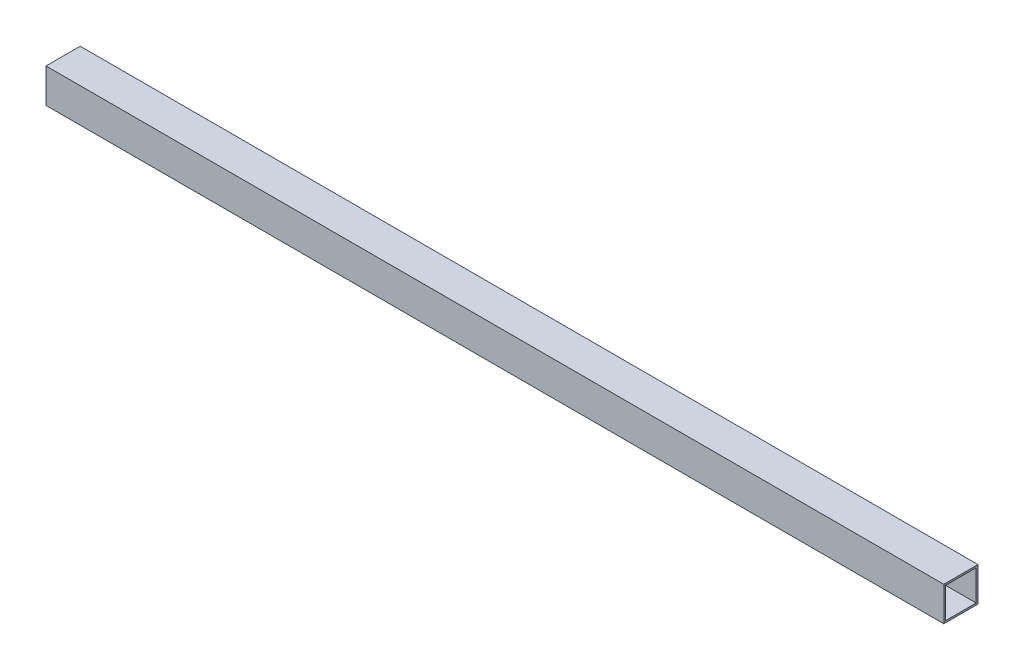
from build123d import *

# Parameters (mm, degrees)
SKETCH1_W           = 19.05
SKETCH1_H           = 19.05
SKETCH1_W_2         = 17.05
SKETCH1_H_2         = 17.05
BOSS_EXTRUDE1_DEPTH = 500


with BuildPart() as part:
    # Sketch1 → Boss-Extrude1 (new body)
    with BuildSketch(Plane(origin=(0, 0, 0), x_dir=(0, 0, -1), z_dir=(1, 0, 0))):
        Rectangle(SKETCH1_W, SKETCH1_H)
        Rectangle(SKETCH1_W_2, SKETCH1_H_2, mode=Mode.SUBTRACT)
    extrude(amount=BOSS_EXTRUDE1_DEPTH)


solid = part.part
